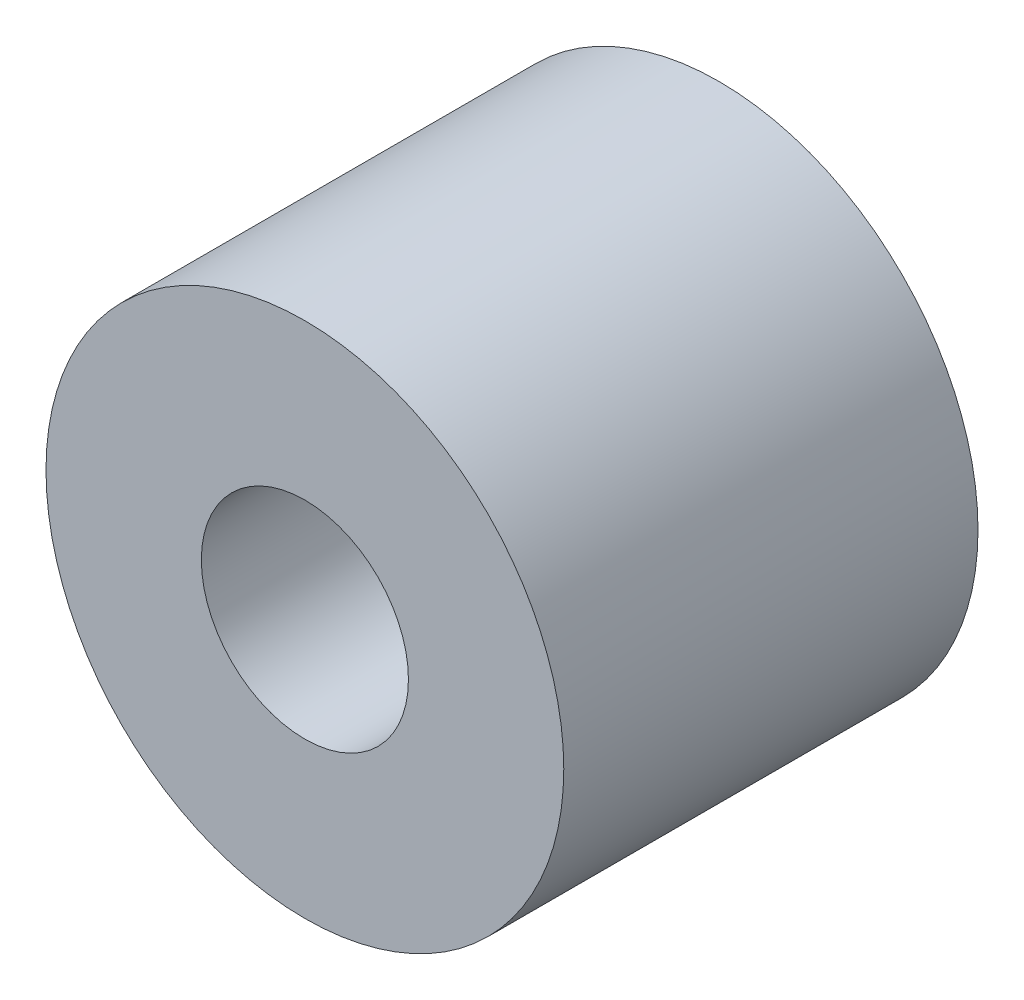
from build123d import *

# Parameters (mm, degrees)
SKETCH1_R           = 25
BOSS_EXTRUDE1_DEPTH = 40
SKETCH2_R           = 10
CUT_EXTRUDE1_DEPTH  = 30


with BuildPart() as part:
    # Sketch1 → Boss-Extrude1 (new body)
    with BuildSketch(Plane.XY):
        Circle(SKETCH1_R)
    extrude(amount=BOSS_EXTRUDE1_DEPTH)

    # Sketch2 → Cut-Extrude1 (cut)
    with BuildSketch(Plane.XY.offset(40)):
        Circle(SKETCH2_R)
    extrude(amount=-CUT_EXTRUDE1_DEPTH, mode=Mode.SUBTRACT)


solid = part.part
